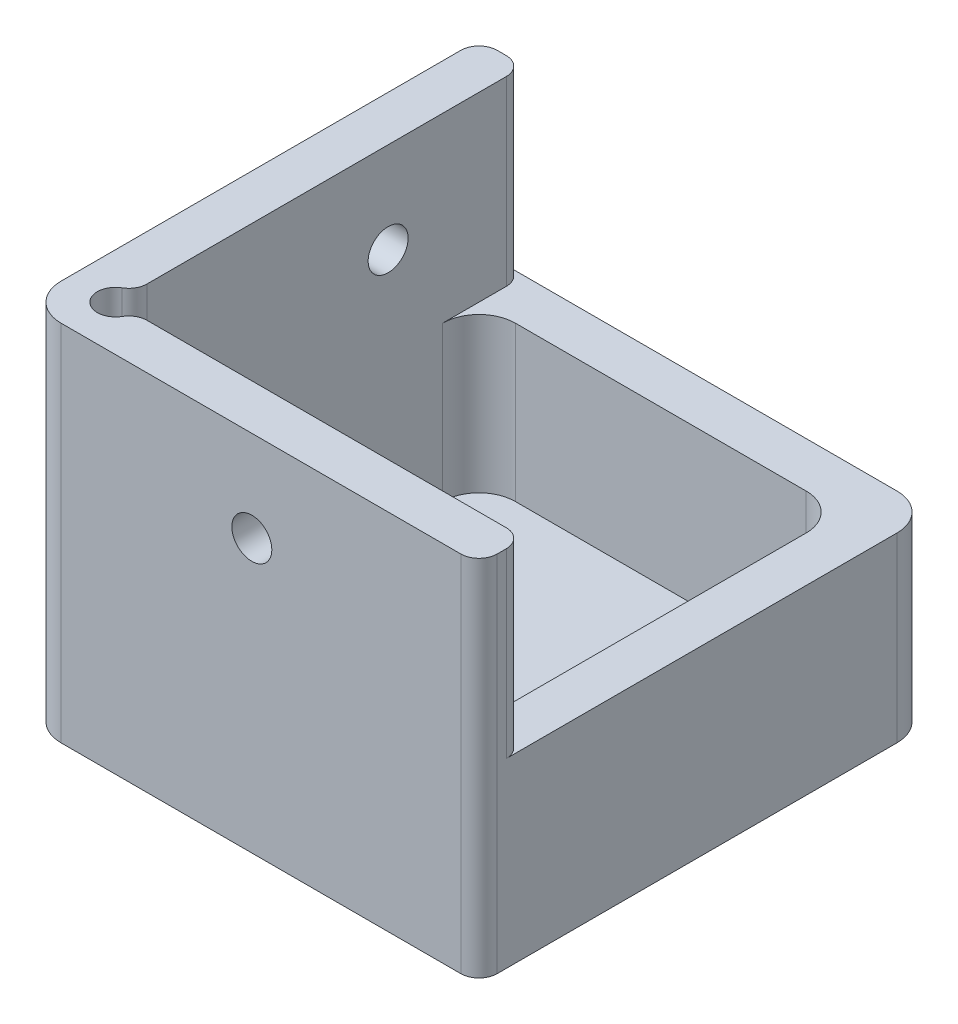
from build123d import *

# Parameters (mm, degrees)
EXTRUDE_1_DEPTH     = 20
CUT_EXTRUDE_2_REACH = 75.485
SKETCH_4_R          = 2.2
CUT_EXTRUDE_3_REACH = 75.485
SKETCH_5_R          = 2.2
SKETCH_3_W          = 50
SKETCH_3_H          = 50
EXTRUDE_2_DEPTH     = 20
SKETCH_10_W         = 40
SKETCH_10_H         = 40
CUT_EXTRUDE_5_DEPTH = 17
SKETCH_6_R          = 2
CUT_EXTRUDE_4_DEPTH = 37
FILLET_1_R          = 4
FILLET_2_R          = 2


with BuildPart() as part:
    # ｽｹｯﾁ1 → ﾎﾞｽ - 押し出し1 (new body)
    with BuildSketch(Plane(origin=(0, 0, 0), x_dir=(1, 0, 0), z_dir=(0, 1, 0))):
        Polygon((0, 0), (50, 0), (50, 5), (5, 5), (5, 50), (0, 50), align=None)
    extrude(amount=EXTRUDE_1_DEPTH)

    # ｽｹｯﾁ4 → ｶｯﾄ - 押し出し2 (cut, up to next)
    with BuildSketch(Plane.ZY, mode=Mode.PRIVATE) as cut_extrude_2_sk1:
        with Locations((-35, 10)):
            Circle(SKETCH_4_R)
    cut_extrude_2_tool1 = extrude(cut_extrude_2_sk1.sketch, amount=-CUT_EXTRUDE_2_REACH, mode=Mode.PRIVATE) & part.part
    add(cut_extrude_2_tool1.solids().sort_by_distance((0, 10, -35))[0], mode=Mode.SUBTRACT)

    # ｽｹｯﾁ5 → ｶｯﾄ - 押し出し3 (cut, up to next)
    with BuildSketch(Plane.XY, mode=Mode.PRIVATE) as cut_extrude_3_sk1:
        with Locations((25, 10)):
            Circle(SKETCH_5_R)
    cut_extrude_3_tool1 = extrude(cut_extrude_3_sk1.sketch, amount=-CUT_EXTRUDE_3_REACH, mode=Mode.PRIVATE) & part.part
    add(cut_extrude_3_tool1.solids().sort_by_distance((25, 10, 0))[0], mode=Mode.SUBTRACT)

    # ｽｹｯﾁ3 → ﾎﾞｽ - 押し出し2 (add)
    with BuildSketch(Plane.XZ):
        with Locations((25, -25)):
            Rectangle(SKETCH_3_W, SKETCH_3_H)
    extrude(amount=EXTRUDE_2_DEPTH)

    # ｽｹｯﾁ10 → ｶｯﾄ - 押し出し5 (cut)
    with BuildSketch(Plane(origin=(0, 0, 0), x_dir=(1, 0, 0), z_dir=(0, 1, 0))):
        with Locations((25, 25)):
            Rectangle(SKETCH_10_W, SKETCH_10_H)
    extrude(amount=-CUT_EXTRUDE_5_DEPTH, mode=Mode.SUBTRACT)

    # ｽｹｯﾁ6 → ｶｯﾄ - 押し出し4 (cut)
    with BuildSketch(Plane(origin=(0, 20, 0), x_dir=(1, 0, 0), z_dir=(0, 1, 0))):
        with Locations((5, 5)):
            Circle(SKETCH_6_R)
    extrude(amount=-CUT_EXTRUDE_4_DEPTH, mode=Mode.SUBTRACT)

    # ﾌｨﾚｯﾄ1
    fillet_1_edges = [part.edges().sort_by_distance(p)[0] for p in [
        (0, 0, 0),
        (50, -10, -50),
        (45, -8.5, -5),
        (45, -8.5, -45),
        (5, -8.5, -45),
    ]]
    fillet(fillet_1_edges, radius=FILLET_1_R)

    # ﾌｨﾚｯﾄ2
    fillet_2_edges = [part.edges().sort_by_distance(p)[0] for p in [
        (0, 0, -50),
        (5, 10, -50),
        (50, 10, -5),
        (50, 0, 0),
        (7, 1.5, -5),
        (5, 1.5, -7),
    ]]
    fillet(fillet_2_edges, radius=FILLET_2_R)


solid = part.part
